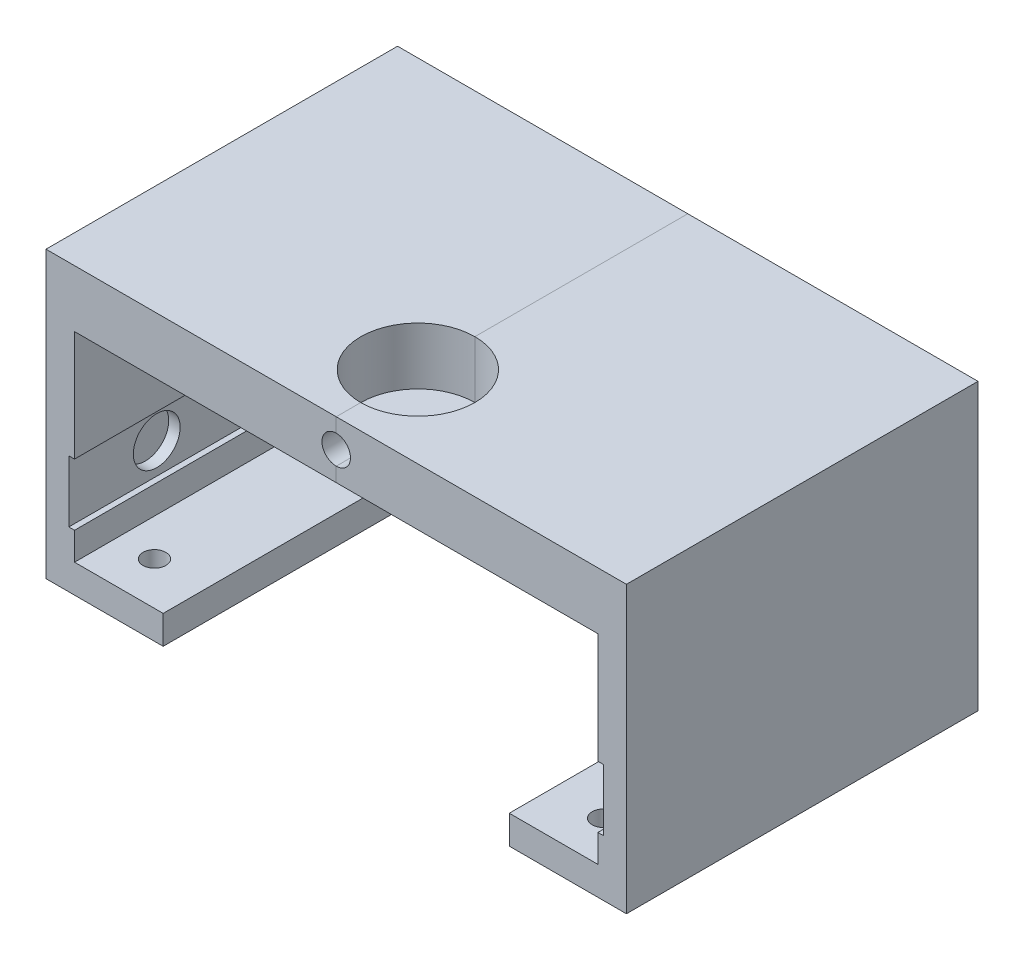
from build123d import *

# Parameters (mm, degrees)
SALIENTE_EXTRUIR1_DEPTH    = 10
CROQUIS3_R                 = 10
CORTAR_EXTRUIR1_DEPTH      = 10
CROQUIS4_R                 = 2.5
CORTAR_EXTRUIR2_DEPTH      = 10
CROQUIS6_W                 = 5
CROQUIS6_H                 = 61.6
SALIENTE_EXTRUIR2_DEPTH    = 50
CROQUIS7_W                 = 15.529327094
CROQUIS7_H                 = 61.6
SALIENTE_EXTRUIR3_DEPTH    = 5
CROQUIS8_R                 = 2
CORTAR_EXTRUIR3_DEPTH      = 10
CROQUIS9_W                 = 1
CROQUIS9_H                 = 10.8
CORTAR_EXTRUIR4_DEPTH      = 100
CORTAR_EXTRUIR5_DEPTH      = 95.7
CORTAR_EXTRUIR5_DEPTH_BACK = 2
CROQUIS11_R                = 4.103892148


with BuildPart() as part:
    # Croquis1 → Saliente-Extruir1 (new body)
    with BuildSketch(Plane(origin=(0, 0, 0), x_dir=(1, 0, 0), z_dir=(0, 1, 0))):
        Polygon((-45.85, 14.3), (-45.85, 47.3), (45.85, 47.3), (45.85, 14.3), (45.85, -14.3), (-45.85, -14.3), align=None)
    extrude(amount=SALIENTE_EXTRUIR1_DEPTH)

    # Croquis3 → Cortar-Extruir1 (cut)
    with BuildSketch(Plane(origin=(0, 10, 0), x_dir=(1, 0, 0), z_dir=(0, 1, 0))):
        with Locations(Location((0, 0, 0), (0, 0, 270))):
            Circle(CROQUIS3_R)
    extrude(amount=-CORTAR_EXTRUIR1_DEPTH, mode=Mode.SUBTRACT)

    # Croquis4 → Cortar-Extruir2 (cut)
    with BuildSketch(Plane.XY.offset(14.3)):
        with Locations((0, 5)):
            Circle(CROQUIS4_R)
    extrude(amount=-CORTAR_EXTRUIR2_DEPTH, mode=Mode.SUBTRACT)

    # Croquis6 → Saliente-Extruir2 (add)
    with BuildSketch(Plane(origin=(0, 10, 0), x_dir=(1, 0, 0), z_dir=(0, 1, 0))):
        with Locations((-48.35, 16.5)):
            Rectangle(CROQUIS6_W, CROQUIS6_H)
        with Locations((48.35, 16.5)):
            Rectangle(CROQUIS6_W, CROQUIS6_H)
    extrude(amount=-SALIENTE_EXTRUIR2_DEPTH)

    # Croquis7 → Saliente-Extruir3 (add)
    with BuildSketch(Plane.XZ.offset(40)):
        with Locations((-38.085336453, -16.5)):
            Rectangle(CROQUIS7_W, CROQUIS7_H)
        with Locations((38.085336453, -16.5)):
            Rectangle(CROQUIS7_W, CROQUIS7_H)
    extrude(amount=-SALIENTE_EXTRUIR3_DEPTH)

    # Croquis8 → Cortar-Extruir3 (cut)
    with BuildSketch(Plane.XZ.offset(40)):
        with Locations(Location((-39.35, 6.8, 0), (0, 0, 270))):
            Circle(CROQUIS8_R)
        with Locations(Location((39.35, 6.8, 0), (0, 0, 270))):
            Circle(CROQUIS8_R)
    extrude(amount=-CORTAR_EXTRUIR3_DEPTH, mode=Mode.SUBTRACT)

    # Croquis9 → Cortar-Extruir4 (cut)
    with BuildSketch(Plane.XY.offset(14.3)):
        with Locations((-46.35, -24.75)):
            Rectangle(CROQUIS9_W, CROQUIS9_H)
        with Locations((46.35, -24.75)):
            Rectangle(CROQUIS9_W, CROQUIS9_H)
    extrude(amount=-CORTAR_EXTRUIR4_DEPTH, mode=Mode.SUBTRACT)

    # Croquis11 → Cortar-Extruir5 (cut, two sides: drawn at the far end of the back side and taken through both)
    with BuildSketch(Plane(origin=(-46.85, 0, 0), x_dir=(0, 0, -1), z_dir=(1, 0, 0)).offset(-CORTAR_EXTRUIR5_DEPTH_BACK)):
        with Locations((1.1, -24.75)):
            Circle(CROQUIS11_R)
        with Locations(Location((31.9, -24.75, 0), (0, 0, 180))):
            Circle(CROQUIS11_R)
    extrude(amount=CORTAR_EXTRUIR5_DEPTH + CORTAR_EXTRUIR5_DEPTH_BACK, mode=Mode.SUBTRACT)


with BuildPart() as body_2:
    # Partir1: the piece on the far side of the plane
    add(part.part)
    split(bisect_by=Plane(origin=(0, 0, 0), x_dir=(0, 0, 1), z_dir=(1, 0, 0)), keep=Keep.BOTTOM)


with BuildPart() as part_1:
    add(part.part)

    # Partir1
    split(bisect_by=Plane(origin=(0, 0, 0), x_dir=(0, 0, 1), z_dir=(1, 0, 0)), keep=Keep.TOP)


solid = Compound([body_2.part, part_1.part])
